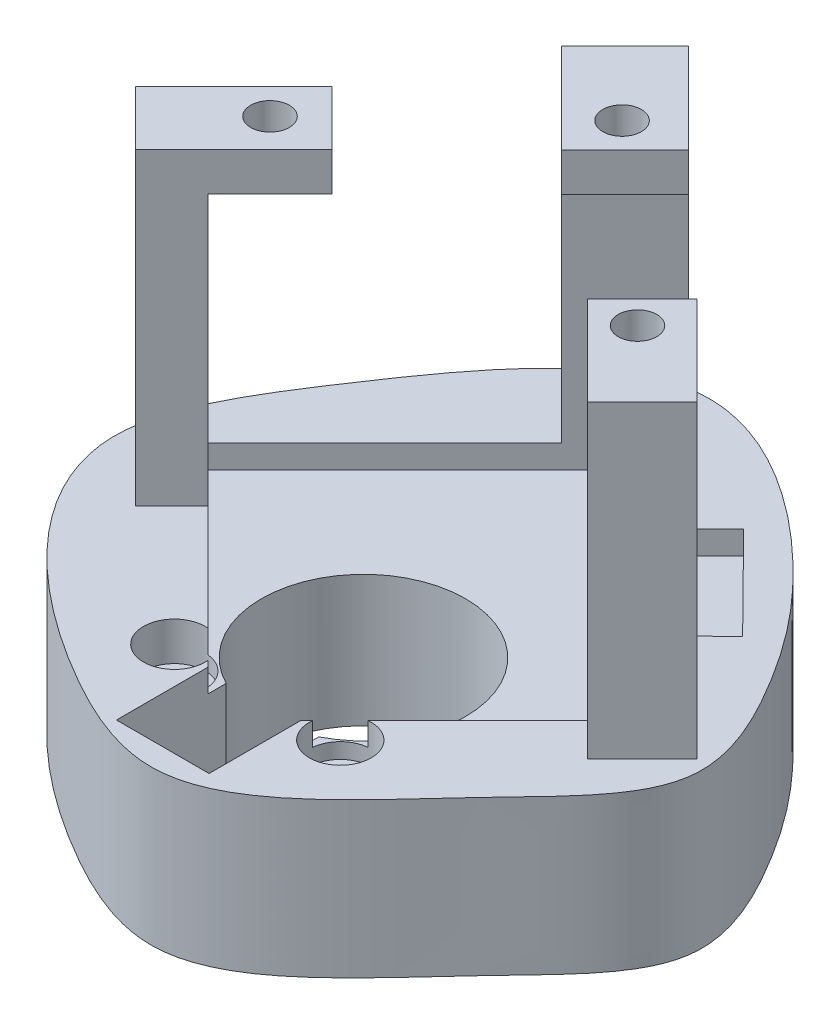
from build123d import *

# Parameters (mm, degrees)
BOSS_EXTRUDE1_DEPTH      = 10
BOSS_EXTRUDE1_DEPTH_BACK = 10
SKETCH2_R                = 60
SKETCH7_R                = 4
CUT_EXTRUDE2_DEPTH       = 5
CUT_EXTRUDE4_DEPTH       = 3
CUT_EXTRUDE5_DEPTH       = 3
BOSS_EXTRUDE2_DEPTH      = 35
BOSS_EXTRUDE3_DEPTH      = 5
SKETCH13_R               = 2.5
CUT_EXTRUDE7_DEPTH       = 5
SKETCH15_R               = 2.5
CUT_EXTRUDE8_DEPTH       = 5
SKETCH14_R               = 2.5
CUT_EXTRUDE9_DEPTH       = 5
SKETCH16_R               = 60
CUT_EXTRUDE10_DEPTH      = 38
SKETCH4_R                = 13.225
CUT_EXTRUDE12_DEPTH      = 42
SKETCH19_W               = 12
SKETCH19_H               = 20
CUT_EXTRUDE13_DEPTH      = 17


with BuildPart() as part:
    # Sketch2 → Boss-Extrude1 (new, two sides: drawn at the far end of the back side and taken through both)
    with BuildSketch(Plane(origin=(0, 0, 0), x_dir=(1, 0, 0), z_dir=(0, 1, 0)).offset(-BOSS_EXTRUDE1_DEPTH_BACK)):
        Circle(SKETCH2_R)
    extrude(amount=BOSS_EXTRUDE1_DEPTH + BOSS_EXTRUDE1_DEPTH_BACK)

    # Sketch7 → Cut-Extrude2 (cut)
    with BuildSketch(Plane(origin=(0, 10, 0), x_dir=(1, 0, 0), z_dir=(0, 1, 0))):
        with Locations((-10.75, -7.75)):
            Circle(SKETCH7_R)
    cut_extrude2 = extrude(amount=-CUT_EXTRUDE2_DEPTH, mode=Mode.SUBTRACT)

    # Mirror1: Cut-Extrude2 across plane
    add(cut_extrude2.mirror(Plane(origin=(0, 0, 0), x_dir=(0, 0, 1), z_dir=(1, 0, 0))), mode=Mode.SUBTRACT)

    # Sketch9 → Cut-Extrude4 (cut)
    with BuildSketch(Plane(origin=(0, 10, 0), x_dir=(1, 0, 0), z_dir=(0, 1, 0))):
        Polygon((-31.112706744, 17), (-8.372e-06, 48.112698372), (31.11269, 17), (-8.372e-06, -14.112698372), align=None)
    extrude(amount=-CUT_EXTRUDE4_DEPTH, mode=Mode.SUBTRACT)

    # Sketch6 → Cut-Extrude5 (cut)
    with BuildSketch(Plane(origin=(0, 10, 0), x_dir=(1, 0, 0), z_dir=(0, 1, 0))):
        Polygon((-5.977874391, 23.042765738), (5.977874391, 10.957234262), (25.17254203, 29.945776443), (13.216793249, 42.03130792), align=None)
    extrude(amount=-CUT_EXTRUDE5_DEPTH, mode=Mode.SUBTRACT)

    # Sketch11 → Boss-Extrude2 (add)
    with BuildSketch(Plane(origin=(0, 10, 0), x_dir=(1, 0, 0), z_dir=(0, 1, 0))):
        Polygon((-8.372e-06, 48.112698372), (-8.240017503, 39.872689242), (-12.799306685, 44.431978425), (-4.559297555, 52.671987555), align=None)
        Polygon((-31.112706744, 17), (-24.041638933, 9.928932188), (-28.755220541, 5.21535058), (-35.826288353, 12.286418392), align=None)
        Polygon((31.644591703, 17.531901703), (24.573523891, 10.460833891), (28.864455193, 6.169902588), (35.935523005, 13.2409704), align=None)
    extrude(amount=BOSS_EXTRUDE2_DEPTH)

    # Sketch12 → Boss-Extrude3 (add)
    with BuildSketch(Plane(origin=(0, 45, 0), x_dir=(1, 0, 0), z_dir=(0, 1, 0))):
        Polygon((-4.559297555, 52.671987555), (-12.799306685, 44.431978425), (-1.132044796, 32.764716535), (7.107964335, 41.004725665), align=None)
        Polygon((-35.826288353, 12.286418392), (-28.755220541, 5.21535058), (-16.027298479, 17.943272641), (-23.098366291, 25.014340453), align=None)
        Polygon((35.935523005, 13.2409704), (28.864455193, 6.169902588), (17.266701717, 17.767656064), (24.337769529, 24.838723876), align=None)
    extrude(amount=BOSS_EXTRUDE3_DEPTH)

    # Sketch13 → Cut-Extrude7 (cut)
    with BuildSketch(Plane(origin=(0, 50, 0), x_dir=(1, 0, 0), z_dir=(0, 1, 0))):
        with Locations((-0.5, 40)):
            Circle(SKETCH13_R)
    extrude(amount=-CUT_EXTRUDE7_DEPTH, mode=Mode.SUBTRACT)

    # Sketch15 → Cut-Extrude8 (cut)
    with BuildSketch(Plane(origin=(0, 50, 0), x_dir=(1, 0, 0), z_dir=(0, 1, 0))):
        with Locations((-23.777002133, 17.668993601)):
            Circle(SKETCH15_R)
    extrude(amount=-CUT_EXTRUDE8_DEPTH, mode=Mode.SUBTRACT)

    # Sketch14 → Cut-Extrude9 (cut)
    with BuildSketch(Plane(origin=(0, 50, 0), x_dir=(1, 0, 0), z_dir=(0, 1, 0))):
        with Locations((23.5, 18)):
            Circle(SKETCH14_R)
    extrude(amount=-CUT_EXTRUDE9_DEPTH, mode=Mode.SUBTRACT)

    # Sketch16 → Cut-Extrude10 (cut)
    with BuildSketch(Plane(origin=(0, 10, 0), x_dir=(1, 0, 0), z_dir=(0, 1, 0))):
        Circle(SKETCH16_R)
        with BuildLine():
            add(Edge.make_bspline(
                [(-4.79445414, 54.411479542), (3.711953261, 55.123778385), (20.176812176, 43.163893552), (32.095851639, 27.739664068), (41.103501035, 9.384731909), (23.441378071, -7.012281145), (7.387216057, -27.669539214), (-20.675561177, -15.265601832), (-45.215914175, 6.863059518), (-27.534475147, 35.312307502), (-14.416385352, 53.60577037), (-4.79445414, 54.411479542)],
                knots=[0, 0, 0, 0, 0.129983166, 0.216069769, 0.283536175, 0.368923683, 0.507401419, 0.580069943, 0.753753629, 0.852970941, 1, 1, 1, 1], degree=3))
        make_face(mode=Mode.SUBTRACT)
    extrude(amount=-CUT_EXTRUDE10_DEPTH, mode=Mode.SUBTRACT)

    # Sketch4 → Cut-Extrude12 (cut)
    with BuildSketch(Plane(origin=(0, 10, 0), x_dir=(1, 0, 0), z_dir=(0, 1, 0))):
        with Locations((0, 6)):
            Circle(SKETCH4_R)
    extrude(amount=-CUT_EXTRUDE12_DEPTH, mode=Mode.SUBTRACT)

    # Sketch19 → Cut-Extrude13 (cut)
    with BuildSketch(Plane(origin=(0, 10, 0), x_dir=(1, 0, 0), z_dir=(0, 1, 0))):
        with Locations((0, -10)):
            Rectangle(SKETCH19_W, SKETCH19_H)
    extrude(amount=-CUT_EXTRUDE13_DEPTH, mode=Mode.SUBTRACT)


solid = part.part
